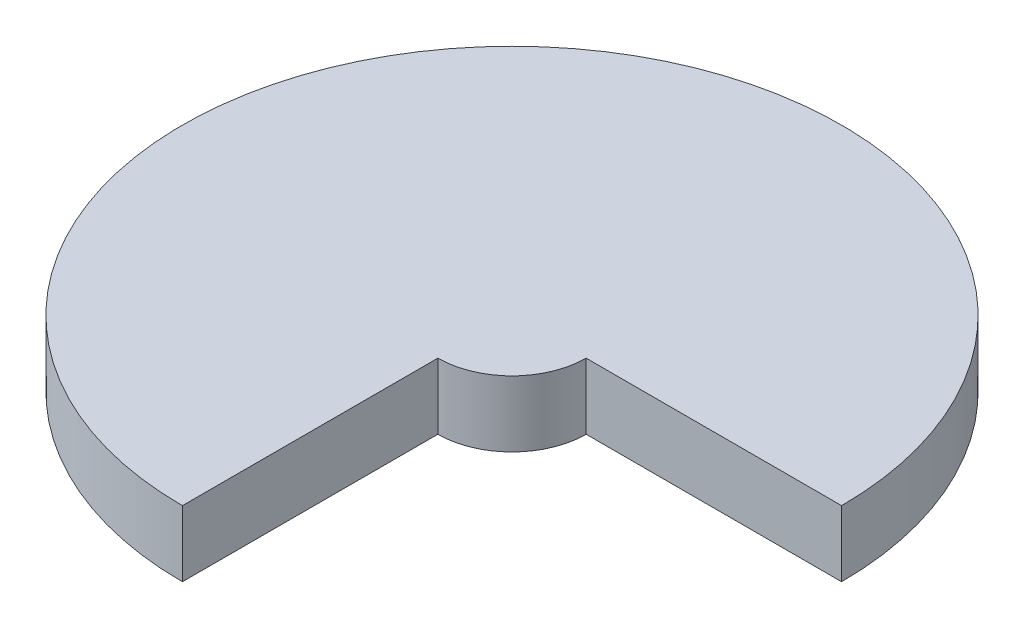
from build123d import *

# Parameters (mm, degrees)
BOSS_EXTRUDE1_DEPTH = 20


with BuildPart() as part:
    # Sketch1 → Boss-Extrude1 (new body)
    with BuildSketch(Plane(origin=(0, 0, 0), x_dir=(1, 0, 0), z_dir=(0, 1, 0))):
        with BuildLine():
            Line((100, 0), (22.5, 0))
            ThreePointArc((22.5, 0), (15.909902577, -15.909902577), (0, -22.5))
            Line((0, -22.5), (0, -100))
            ThreePointArc((0, -100), (-70.710678119, 70.710678119), (100, 0))
        make_face()
    extrude(amount=BOSS_EXTRUDE1_DEPTH)


solid = part.part
